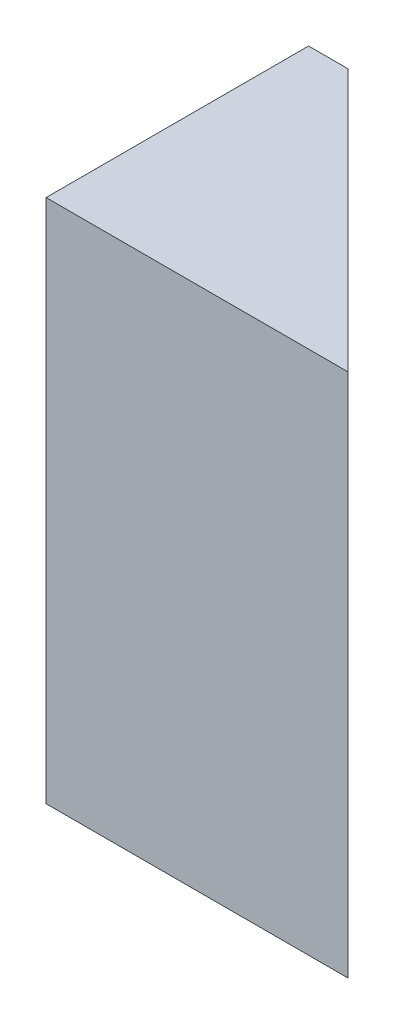
from build123d import *

# Parameters (mm, degrees)
EXTRUDE_1_DEPTH = 80


with BuildPart() as part:
    # Эскиз1 → Бобышка-Вытянуть1 (new body)
    with BuildSketch(Plane(origin=(0, 0, 0), x_dir=(1, 0, 0), z_dir=(0, 1, 0))):
        Polygon((0, 0), (40, 0), (0, 40), (-6, 40), (-6, 0), align=None)
    extrude(amount=EXTRUDE_1_DEPTH)


solid = part.part
